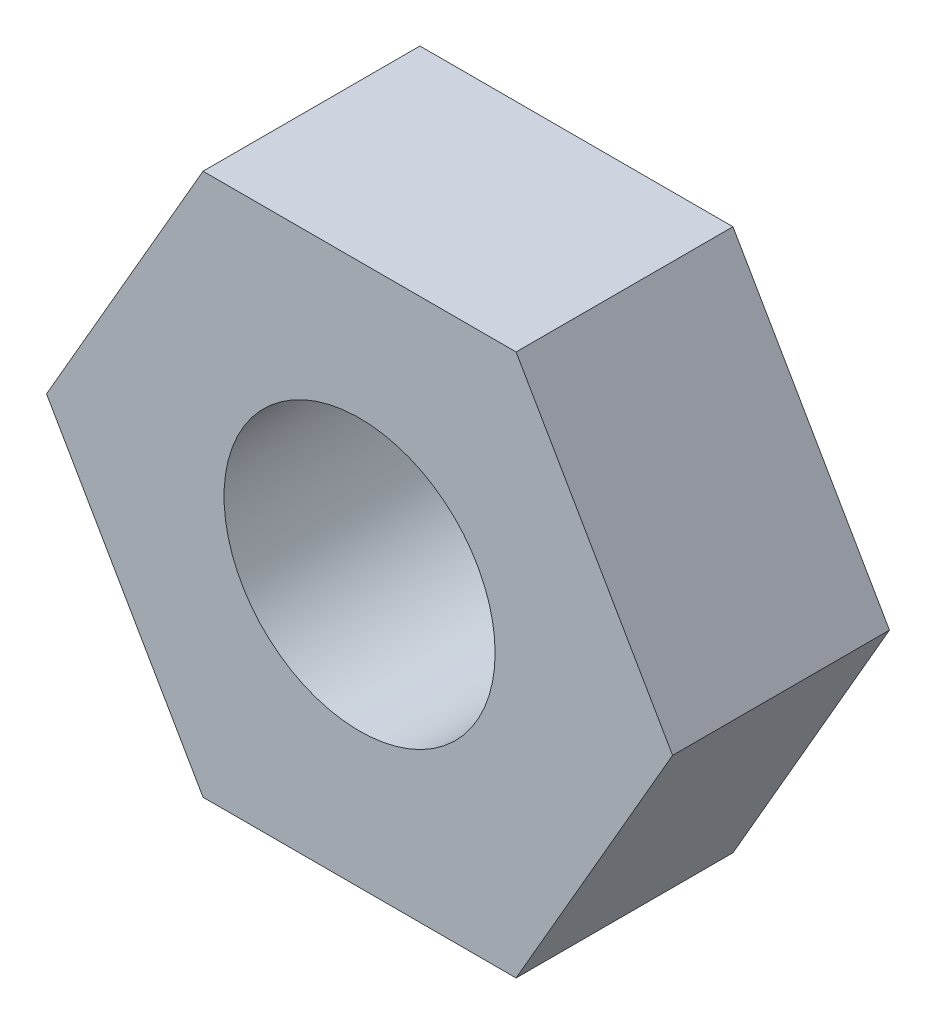
from build123d import *

# Parameters (mm, degrees)
ESQUISSE1_R        = 1
BOSS_EXTRU_1_DEPTH = 1.6


with BuildPart() as part:
    # Esquisse1 → Boss.-Extru.1 (new body)
    with BuildSketch(Plane.XY):
        Polygon((2.309401077, 0), (1.154700538, 2), (-1.154700538, 2), (-2.309401077, 0), (-1.154700538, -2), (1.154700538, -2), align=None)
        Circle(ESQUISSE1_R, mode=Mode.SUBTRACT)
    extrude(amount=BOSS_EXTRU_1_DEPTH)


solid = part.part
